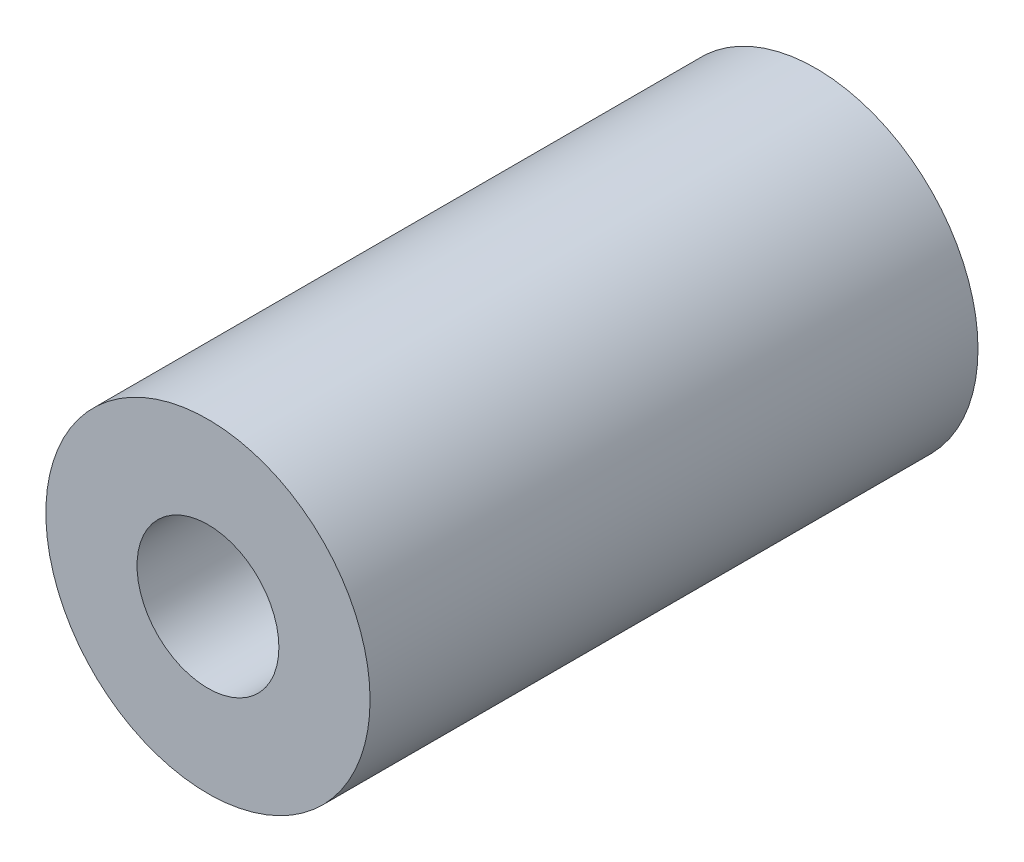
from build123d import *

# Parameters (mm, degrees)
ESQUISSE1_R        = 4
ESQUISSE1_R_2      = 1.75
BOSS_EXTRU_1_DEPTH = 7.5


with BuildPart() as part:
    # Esquisse1 → Boss.-Extru.1 (new, symmetric)
    with BuildSketch(Plane.XY):
        Circle(ESQUISSE1_R)
        Circle(ESQUISSE1_R_2, mode=Mode.SUBTRACT)
    extrude(amount=BOSS_EXTRU_1_DEPTH, both=True)


solid = part.part
